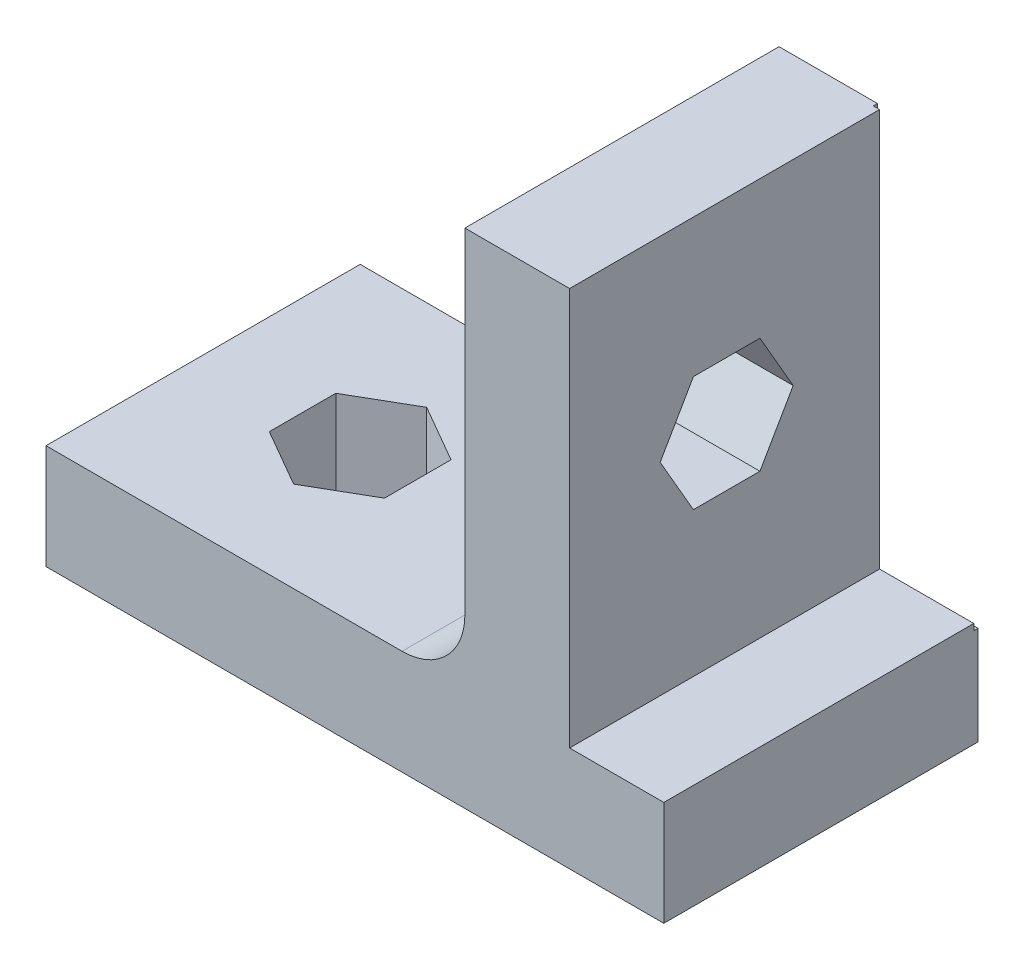
from build123d import *

# Parameters (mm, degrees)
BOSS_EXTRUDE1_DEPTH = 15
CUT_EXTRUDE1_DEPTH  = 39.160843806
CUT_EXTRUDE2_DEPTH  = 38.762415177
CUT_EXTRUDE4_DEPTH  = 0.2
FILLET1_R           = 3


with BuildPart() as part:
    # Sketch2 → Boss-Extrude1 (new body)
    with BuildSketch(Plane.XY):
        Polygon((0, 0), (29.5, 0), (29.5, 5), (25, 5), (25, 24), (20, 24), (20, 5), (0, 5), align=None)
    extrude(amount=BOSS_EXTRUDE1_DEPTH)

    # Sketch3 → Cut-Extrude1 (cut, through all)
    with BuildSketch(Plane(origin=(0, 5, 0), x_dir=(1, 0, 0), z_dir=(0, 1, 0))):
        Polygon((10.25, -5.91228676), (7.5, -4.324573519), (4.75, -5.91228676), (4.75, -9.08771324), (7.5, -10.675426481), (10.25, -9.08771324), align=None)
        Polygon((44.25, -9.08771324), (44.25, -5.91228676), (47, -4.324573519), (49.75, -5.91228676), (49.75, -9.08771324), (47, -10.675426481), align=None)
    extrude(amount=-CUT_EXTRUDE1_DEPTH, mode=Mode.SUBTRACT)

    # Sketch4 → Cut-Extrude2 (cut, through all)
    with BuildSketch(Plane(origin=(25, 0, 0), x_dir=(0, 0, -1), z_dir=(1, 0, 0))):
        Polygon((-5.91228676, 11.9), (-4.324573519, 14.65), (-5.91228676, 17.4), (-9.08771324, 17.4), (-10.675426481, 14.65), (-9.08771324, 11.9), align=None)
    extrude(amount=-CUT_EXTRUDE2_DEPTH, mode=Mode.SUBTRACT)

    # Sketch5 → Cut-Extrude4 (cut)
    with BuildSketch(Plane(origin=(0, 0, 0), x_dir=(-1, 0, 0), z_dir=(0, 0, -1))):
        Polygon((-24.7, 4.7), (-24.7, 23.7), (-24.7, 24), (-25, 24), (-25, 5), (-29.5, 5), (-29.5, 4.7), align=None)
    extrude(amount=-CUT_EXTRUDE4_DEPTH, mode=Mode.SUBTRACT)

    # Fillet1
    fillet1_edges = [part.edges().sort_by_distance(p)[0] for p in [
        (20, 5, 7.5),
    ]]
    fillet(fillet1_edges, radius=FILLET1_R)


solid = part.part
